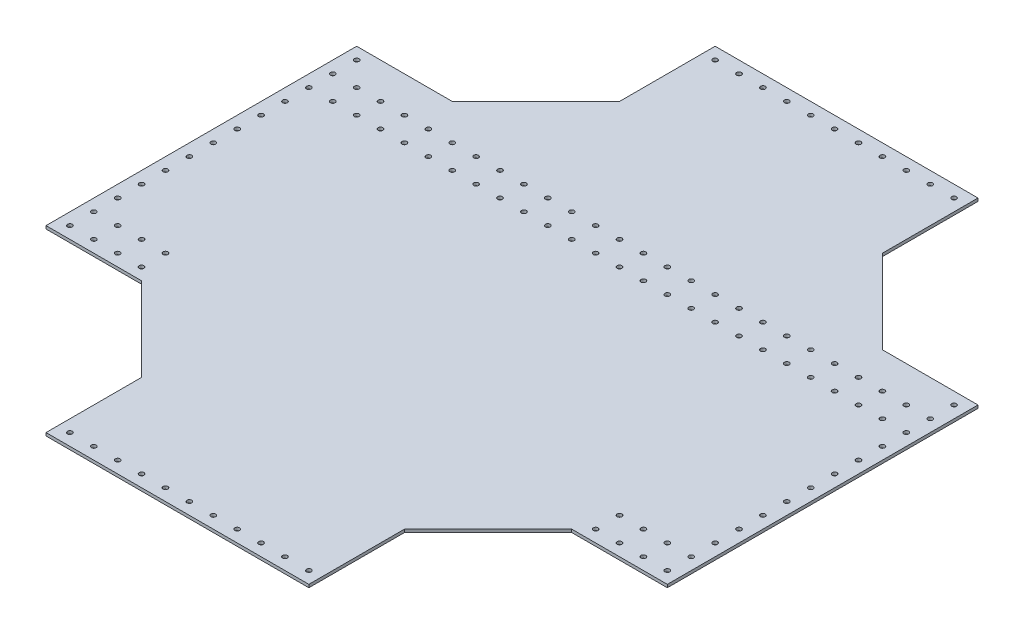
from build123d import *

# Parameters (mm, degrees)
SKETCH1_R           = 2.54
BOSS_EXTRUDE1_DEPTH = 3.175


with BuildPart() as part:
    # Sketch1 → Boss-Extrude1 (new body)
    with BuildSketch(Plane(origin=(0, 0, 0), x_dir=(1, 0, 0), z_dir=(0, 1, 0))):
        Polygon((0, 0), (0, 101.6), (279.4, 101.6), (279.4, 0), (368.304535599, -88.904535599), (469.904535599, -88.904535599), (469.904535599, -419.104535599), (368.304535599, -419.104535599), (279.4, -508.009071197), (279.4, -609.609071197), (0, -609.609071197), (0, -508.009071197), (-88.904535599, -419.104535599), (-190.504535599, -419.104535599), (-190.504535599, -88.904535599), (-88.904535599, -88.904535599), align=None)
        with Locations(Location((-177.804535599, -101.604535599, 0), (0, 0, 270))):
            Circle(SKETCH1_R, mode=Mode.SUBTRACT)
        with Locations(Location((-177.804535599, -127.004535599, 0), (0, 0, 270))):
            Circle(SKETCH1_R, mode=Mode.SUBTRACT)
        with Locations(Location((-177.804535599, -152.404535599, 0), (0, 0, 270))):
            Circle(SKETCH1_R, mode=Mode.SUBTRACT)
        with Locations(Location((-177.804535599, -177.804535599, 0), (0, 0, 270))):
            Circle(SKETCH1_R, mode=Mode.SUBTRACT)
        with Locations(Location((-177.804535599, -203.204535599, 0), (0, 0, 270))):
            Circle(SKETCH1_R, mode=Mode.SUBTRACT)
        with Locations(Location((-177.804535599, -228.604535599, 0), (0, 0, 270))):
            Circle(SKETCH1_R, mode=Mode.SUBTRACT)
        with Locations(Location((-177.804535599, -254.004535599, 0), (0, 0, 270))):
            Circle(SKETCH1_R, mode=Mode.SUBTRACT)
        with Locations(Location((-177.804535599, -279.404535599, 0), (0, 0, 270))):
            Circle(SKETCH1_R, mode=Mode.SUBTRACT)
        with Locations(Location((-177.804535599, -304.804535599, 0), (0, 0, 270))):
            Circle(SKETCH1_R, mode=Mode.SUBTRACT)
        with Locations(Location((-177.804535599, -330.204535599, 0), (0, 0, 270))):
            Circle(SKETCH1_R, mode=Mode.SUBTRACT)
        with Locations(Location((-177.804535599, -355.604535599, 0), (0, 0, 270))):
            Circle(SKETCH1_R, mode=Mode.SUBTRACT)
        with Locations(Location((-177.804535599, -381.004535599, 0), (0, 0, 270))):
            Circle(SKETCH1_R, mode=Mode.SUBTRACT)
        with Locations(Location((-177.804535599, -406.404535599, 0), (0, 0, 270))):
            Circle(SKETCH1_R, mode=Mode.SUBTRACT)
        with Locations(Location((457.204535599, -406.404535599, 0), (0, 0, 270))):
            Circle(SKETCH1_R, mode=Mode.SUBTRACT)
        with Locations(Location((457.204535599, -381.004535599, 0), (0, 0, 270))):
            Circle(SKETCH1_R, mode=Mode.SUBTRACT)
        with Locations(Location((457.204535599, -355.604535599, 0), (0, 0, 270))):
            Circle(SKETCH1_R, mode=Mode.SUBTRACT)
        with Locations(Location((457.204535599, -330.204535599, 0), (0, 0, 270))):
            Circle(SKETCH1_R, mode=Mode.SUBTRACT)
        with Locations(Location((457.204535599, -304.804535599, 0), (0, 0, 270))):
            Circle(SKETCH1_R, mode=Mode.SUBTRACT)
        with Locations(Location((457.204535599, -279.404535599, 0), (0, 0, 270))):
            Circle(SKETCH1_R, mode=Mode.SUBTRACT)
        with Locations(Location((457.204535599, -254.004535599, 0), (0, 0, 270))):
            Circle(SKETCH1_R, mode=Mode.SUBTRACT)
        with Locations(Location((457.204535599, -228.604535599, 0), (0, 0, 270))):
            Circle(SKETCH1_R, mode=Mode.SUBTRACT)
        with Locations(Location((457.204535599, -152.404535599, 0), (0, 0, 270))):
            Circle(SKETCH1_R, mode=Mode.SUBTRACT)
        with Locations(Location((457.204535599, -177.804535599, 0), (0, 0, 270))):
            Circle(SKETCH1_R, mode=Mode.SUBTRACT)
        with Locations(Location((457.204535599, -203.204535599, 0), (0, 0, 270))):
            Circle(SKETCH1_R, mode=Mode.SUBTRACT)
        with Locations(Location((457.204535599, -127.004535599, 0), (0, 0, 270))):
            Circle(SKETCH1_R, mode=Mode.SUBTRACT)
        with Locations(Location((457.204535599, -101.604535599, 0), (0, 0, 270))):
            Circle(SKETCH1_R, mode=Mode.SUBTRACT)
        with Locations(Location((12.7, 88.9, 0), (0, 0, 270))):
            Circle(SKETCH1_R, mode=Mode.SUBTRACT)
        with Locations(Location((38.1, 88.9, 0), (0, 0, 270))):
            Circle(SKETCH1_R, mode=Mode.SUBTRACT)
        with Locations(Location((63.5, 88.9, 0), (0, 0, 270))):
            Circle(SKETCH1_R, mode=Mode.SUBTRACT)
        with Locations(Location((88.9, 88.9, 0), (0, 0, 270))):
            Circle(SKETCH1_R, mode=Mode.SUBTRACT)
        with Locations(Location((114.3, 88.9, 0), (0, 0, 270))):
            Circle(SKETCH1_R, mode=Mode.SUBTRACT)
        with Locations(Location((139.7, 88.9, 0), (0, 0, 270))):
            Circle(SKETCH1_R, mode=Mode.SUBTRACT)
        with Locations(Location((165.1, 88.9, 0), (0, 0, 270))):
            Circle(SKETCH1_R, mode=Mode.SUBTRACT)
        with Locations(Location((190.5, 88.9, 0), (0, 0, 270))):
            Circle(SKETCH1_R, mode=Mode.SUBTRACT)
        with Locations(Location((215.9, 88.9, 0), (0, 0, 270))):
            Circle(SKETCH1_R, mode=Mode.SUBTRACT)
        with Locations(Location((241.3, 88.9, 0), (0, 0, 270))):
            Circle(SKETCH1_R, mode=Mode.SUBTRACT)
        with Locations(Location((266.7, 88.9, 0), (0, 0, 270))):
            Circle(SKETCH1_R, mode=Mode.SUBTRACT)
        with Locations(Location((266.7, -596.909071197, 0), (0, 0, 270))):
            Circle(SKETCH1_R, mode=Mode.SUBTRACT)
        with Locations(Location((241.3, -596.909071197, 0), (0, 0, 270))):
            Circle(SKETCH1_R, mode=Mode.SUBTRACT)
        with Locations(Location((215.9, -596.909071197, 0), (0, 0, 270))):
            Circle(SKETCH1_R, mode=Mode.SUBTRACT)
        with Locations(Location((190.5, -596.909071197, 0), (0, 0, 270))):
            Circle(SKETCH1_R, mode=Mode.SUBTRACT)
        with Locations(Location((165.1, -596.909071197, 0), (0, 0, 270))):
            Circle(SKETCH1_R, mode=Mode.SUBTRACT)
        with Locations(Location((139.7, -596.909071197, 0), (0, 0, 270))):
            Circle(SKETCH1_R, mode=Mode.SUBTRACT)
        with Locations(Location((114.3, -596.909071197, 0), (0, 0, 270))):
            Circle(SKETCH1_R, mode=Mode.SUBTRACT)
        with Locations(Location((88.9, -596.909071197, 0), (0, 0, 270))):
            Circle(SKETCH1_R, mode=Mode.SUBTRACT)
        with Locations(Location((63.5, -596.909071197, 0), (0, 0, 270))):
            Circle(SKETCH1_R, mode=Mode.SUBTRACT)
        with Locations(Location((38.1, -596.909071197, 0), (0, 0, 270))):
            Circle(SKETCH1_R, mode=Mode.SUBTRACT)
        with Locations(Location((12.7, -596.909071197, 0), (0, 0, 270))):
            Circle(SKETCH1_R, mode=Mode.SUBTRACT)
        with Locations(Location((-101.604535599, -381.004535599, 0), (0, 0, 270))):
            Circle(SKETCH1_R, mode=Mode.SUBTRACT)
        with Locations(Location((-101.604535599, -406.404535599, 0), (0, 0, 270))):
            Circle(SKETCH1_R, mode=Mode.SUBTRACT)
        with Locations(Location((381.004535599, -406.404535599, 0), (0, 0, 270))):
            Circle(SKETCH1_R, mode=Mode.SUBTRACT)
        with Locations(Location((381.004535599, -381.004535599, 0), (0, 0, 270))):
            Circle(SKETCH1_R, mode=Mode.SUBTRACT)
        with Locations(Location((-127.004535599, -406.404535599, 0), (0, 0, 270))):
            Circle(SKETCH1_R, mode=Mode.SUBTRACT)
        with Locations(Location((-152.404535599, -406.404535599, 0), (0, 0, 270))):
            Circle(SKETCH1_R, mode=Mode.SUBTRACT)
        with Locations(Location((-127.004535599, -381.004535599, 0), (0, 0, 270))):
            Circle(SKETCH1_R, mode=Mode.SUBTRACT)
        with Locations(Location((-152.404535599, -381.004535599, 0), (0, 0, 270))):
            Circle(SKETCH1_R, mode=Mode.SUBTRACT)
        with Locations(Location((431.804535599, -381.004535599, 0), (0, 0, 270))):
            Circle(SKETCH1_R, mode=Mode.SUBTRACT)
        with Locations(Location((406.404535599, -381.004535599, 0), (0, 0, 270))):
            Circle(SKETCH1_R, mode=Mode.SUBTRACT)
        with Locations(Location((431.804535599, -406.404535599, 0), (0, 0, 270))):
            Circle(SKETCH1_R, mode=Mode.SUBTRACT)
        with Locations(Location((406.404535599, -406.404535599, 0), (0, 0, 270))):
            Circle(SKETCH1_R, mode=Mode.SUBTRACT)
        with Locations(Location((-152.404535599, -127.004535599, 0), (0, 0, 270))):
            Circle(SKETCH1_R, mode=Mode.SUBTRACT)
        with Locations(Location((-152.404535599, -152.404535599, 0), (0, 0, 270))):
            Circle(SKETCH1_R, mode=Mode.SUBTRACT)
        with Locations(Location((-127.004535599, -127.004535599, 0), (0, 0, 270))):
            Circle(SKETCH1_R, mode=Mode.SUBTRACT)
        with Locations(Location((-127.004535599, -152.404535599, 0), (0, 0, 270))):
            Circle(SKETCH1_R, mode=Mode.SUBTRACT)
        with Locations(Location((-101.604535599, -127.004535599, 0), (0, 0, 270))):
            Circle(SKETCH1_R, mode=Mode.SUBTRACT)
        with Locations(Location((-101.604535599, -152.404535599, 0), (0, 0, 270))):
            Circle(SKETCH1_R, mode=Mode.SUBTRACT)
        with Locations(Location((-76.204535599, -127.004535599, 0), (0, 0, 270))):
            Circle(SKETCH1_R, mode=Mode.SUBTRACT)
        with Locations(Location((-76.204535599, -152.404535599, 0), (0, 0, 270))):
            Circle(SKETCH1_R, mode=Mode.SUBTRACT)
        with Locations(Location((-50.804535599, -127.004535599, 0), (0, 0, 270))):
            Circle(SKETCH1_R, mode=Mode.SUBTRACT)
        with Locations(Location((-50.804535599, -152.404535599, 0), (0, 0, 270))):
            Circle(SKETCH1_R, mode=Mode.SUBTRACT)
        with Locations(Location((-25.404535599, -127.004535599, 0), (0, 0, 270))):
            Circle(SKETCH1_R, mode=Mode.SUBTRACT)
        with Locations(Location((-25.404535599, -152.404535599, 0), (0, 0, 270))):
            Circle(SKETCH1_R, mode=Mode.SUBTRACT)
        with Locations(Location((-0.004535599, -127.004535599, 0), (0, 0, 270))):
            Circle(SKETCH1_R, mode=Mode.SUBTRACT)
        with Locations(Location((-0.004535599, -152.404535599, 0), (0, 0, 270))):
            Circle(SKETCH1_R, mode=Mode.SUBTRACT)
        with Locations(Location((25.395464401, -127.004535599, 0), (0, 0, 270))):
            Circle(SKETCH1_R, mode=Mode.SUBTRACT)
        with Locations(Location((25.395464401, -152.404535599, 0), (0, 0, 270))):
            Circle(SKETCH1_R, mode=Mode.SUBTRACT)
        with Locations(Location((50.795464401, -127.004535599, 0), (0, 0, 270))):
            Circle(SKETCH1_R, mode=Mode.SUBTRACT)
        with Locations(Location((50.795464401, -152.404535599, 0), (0, 0, 270))):
            Circle(SKETCH1_R, mode=Mode.SUBTRACT)
        with Locations(Location((76.195464401, -127.004535599, 0), (0, 0, 270))):
            Circle(SKETCH1_R, mode=Mode.SUBTRACT)
        with Locations(Location((76.195464401, -152.404535599, 0), (0, 0, 270))):
            Circle(SKETCH1_R, mode=Mode.SUBTRACT)
        with Locations(Location((101.595464401, -127.004535599, 0), (0, 0, 270))):
            Circle(SKETCH1_R, mode=Mode.SUBTRACT)
        with Locations(Location((101.595464401, -152.404535599, 0), (0, 0, 270))):
            Circle(SKETCH1_R, mode=Mode.SUBTRACT)
        with Locations(Location((126.995464401, -127.004535599, 0), (0, 0, 270))):
            Circle(SKETCH1_R, mode=Mode.SUBTRACT)
        with Locations(Location((126.995464401, -152.404535599, 0), (0, 0, 270))):
            Circle(SKETCH1_R, mode=Mode.SUBTRACT)
        with Locations(Location((152.395464401, -127.004535599, 0), (0, 0, 270))):
            Circle(SKETCH1_R, mode=Mode.SUBTRACT)
        with Locations(Location((152.395464401, -152.404535599, 0), (0, 0, 270))):
            Circle(SKETCH1_R, mode=Mode.SUBTRACT)
        with Locations(Location((177.795464401, -127.004535599, 0), (0, 0, 270))):
            Circle(SKETCH1_R, mode=Mode.SUBTRACT)
        with Locations(Location((177.795464401, -152.404535599, 0), (0, 0, 270))):
            Circle(SKETCH1_R, mode=Mode.SUBTRACT)
        with Locations(Location((203.195464401, -127.004535599, 0), (0, 0, 270))):
            Circle(SKETCH1_R, mode=Mode.SUBTRACT)
        with Locations(Location((203.195464401, -152.404535599, 0), (0, 0, 270))):
            Circle(SKETCH1_R, mode=Mode.SUBTRACT)
        with Locations(Location((228.595464401, -127.004535599, 0), (0, 0, 270))):
            Circle(SKETCH1_R, mode=Mode.SUBTRACT)
        with Locations(Location((228.595464401, -152.404535599, 0), (0, 0, 270))):
            Circle(SKETCH1_R, mode=Mode.SUBTRACT)
        with Locations(Location((253.995464401, -127.004535599, 0), (0, 0, 270))):
            Circle(SKETCH1_R, mode=Mode.SUBTRACT)
        with Locations(Location((253.995464401, -152.404535599, 0), (0, 0, 270))):
            Circle(SKETCH1_R, mode=Mode.SUBTRACT)
        with Locations(Location((279.395464401, -127.004535599, 0), (0, 0, 270))):
            Circle(SKETCH1_R, mode=Mode.SUBTRACT)
        with Locations(Location((279.395464401, -152.404535599, 0), (0, 0, 270))):
            Circle(SKETCH1_R, mode=Mode.SUBTRACT)
        with Locations(Location((304.795464401, -127.004535599, 0), (0, 0, 270))):
            Circle(SKETCH1_R, mode=Mode.SUBTRACT)
        with Locations(Location((304.795464401, -152.404535599, 0), (0, 0, 270))):
            Circle(SKETCH1_R, mode=Mode.SUBTRACT)
        with Locations(Location((330.195464401, -127.004535599, 0), (0, 0, 270))):
            Circle(SKETCH1_R, mode=Mode.SUBTRACT)
        with Locations(Location((330.195464401, -152.404535599, 0), (0, 0, 270))):
            Circle(SKETCH1_R, mode=Mode.SUBTRACT)
        with Locations(Location((355.595464401, -127.004535599, 0), (0, 0, 270))):
            Circle(SKETCH1_R, mode=Mode.SUBTRACT)
        with Locations(Location((355.595464401, -152.404535599, 0), (0, 0, 270))):
            Circle(SKETCH1_R, mode=Mode.SUBTRACT)
        with Locations(Location((380.995464401, -127.004535599, 0), (0, 0, 270))):
            Circle(SKETCH1_R, mode=Mode.SUBTRACT)
        with Locations(Location((380.995464401, -152.404535599, 0), (0, 0, 270))):
            Circle(SKETCH1_R, mode=Mode.SUBTRACT)
        with Locations(Location((406.395464401, -127.004535599, 0), (0, 0, 270))):
            Circle(SKETCH1_R, mode=Mode.SUBTRACT)
        with Locations(Location((406.395464401, -152.404535599, 0), (0, 0, 270))):
            Circle(SKETCH1_R, mode=Mode.SUBTRACT)
        with Locations(Location((431.795464401, -127.004535599, 0), (0, 0, 270))):
            Circle(SKETCH1_R, mode=Mode.SUBTRACT)
        with Locations(Location((431.795464401, -152.404535599, 0), (0, 0, 270))):
            Circle(SKETCH1_R, mode=Mode.SUBTRACT)
    extrude(amount=BOSS_EXTRUDE1_DEPTH)


solid = part.part
